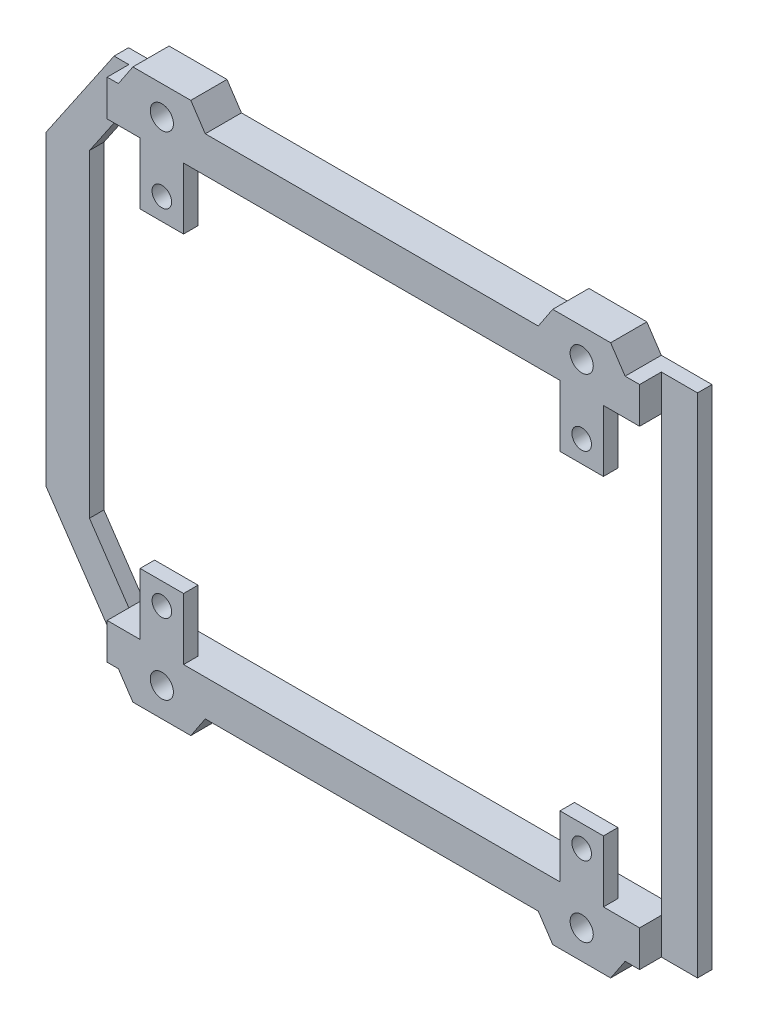
from build123d import *

# Parameters (mm, degrees)
BODY_DEPTH                       = 5
SIDE_EXTRUSION_DEPTH             = 5
MOUNTING_HOLE_D                  = 3.2
MOUNTING_CUTOUT_REACH            = 80.058
SKETCH7_W                        = 3
SKETCH7_H                        = 8.5
SKETCH8_R                        = 1.35
MOUNTING_HOLE_CUTOUT_DEPTH       = 62.424750712
MOUNTING_MIRROR2_COPY_1_DEPTH    = 5
MOUNTING_MIRROR2_COPY_2_D        = 3.2
MOUNTING_MIRROR2_COPY_3_REACH    = 80.058
MOUNTING_MIRROR2_COPY_3_SKETCH_W = 3
MOUNTING_MIRROR2_COPY_3_SKETCH_H = 8.5
MOUNTING_MIRROR2_COPY_4_SKETCH_R = 1.35
MOUNTING_MIRROR2_COPY_4_DEPTH    = 62.424750712
SKETCH9_W                        = 5
SKETCH9_H                        = 70
SKETCH9_W_2                      = 11.445654338
RPI_SPACING_CUTOUT_DEPTH         = 3


with BuildPart() as part:
    # Sketch3 → body (new body)
    with BuildSketch(Plane.XY):
        Polygon((-48, 21.182653996), (-48, -21.182653996), (-38.594438725, -35), (42, -35), (42, 35), (-38.594438725, 35), align=None)
        Polygon((-26, 21.5), (-26, 30), (26, 30), (26, 21.5), (32, 21.5), (32, 30), (37, 30), (37, -30), (32, -30), (32, -21.5), (26, -21.5), (26, -30), (-26, -30), (-26, -21.5), (-32, -21.5), (-32, -30), (-36.554345662, -30), (-42, -22), (-42, 22), (-36.554345662, 30), (-32, 30), (-32, 21.5), align=None, mode=Mode.SUBTRACT)
    extrude(amount=BODY_DEPTH)

    # Sketch4 → side_extrusion (add)
    with BuildSketch(Plane.XY):
        Polygon((-35, 35), (-33, 38), (-25, 38), (-23, 35), align=None)
    side_extrusion = extrude(amount=SIDE_EXTRUSION_DEPTH)

    # mounting_hole (through all)
    with Locations(Plane.XY.offset(5)):
        with Locations((-29, 34)):
            mounting_hole = Hole(MOUNTING_HOLE_D / 2)

    # Sketch7 → mounting_cutout (cut, up to next)
    with BuildSketch(Plane(origin=(-26, 0, 0), x_dir=(0, 0, -1), z_dir=(1, 0, 0)), mode=Mode.PRIVATE) as mounting_cutout_sk1:
        with Locations((-1.5, 25.75)):
            Rectangle(SKETCH7_W, SKETCH7_H)
    mounting_cutout_tool1 = extrude(mounting_cutout_sk1.sketch, amount=-MOUNTING_CUTOUT_REACH, mode=Mode.PRIVATE) & part.part
    mounting_cutout = mounting_cutout_tool1.solids().sort_by_distance((-26, 25.75, 1.5))[0]
    add(mounting_cutout, mode=Mode.SUBTRACT)

    # Sketch8 → mounting_hole_cutout (cut, through all)
    with BuildSketch(Plane.XY.offset(5)):
        with Locations((-29, 24.5)):
            Circle(SKETCH8_R)
    mounting_hole_cutout = extrude(amount=-MOUNTING_HOLE_CUTOUT_DEPTH, mode=Mode.SUBTRACT)

    # mounting_mirror1: side_extrusion, mounting_hole, mounting_cutout, mounting_hole_cutout across plane
    add(side_extrusion.mirror(Plane(origin=(0, 0, 0), x_dir=(0, 0, 1), z_dir=(1, 0, 0))))
    add(mounting_hole.mirror(Plane(origin=(0, 0, 0), x_dir=(0, 0, 1), z_dir=(1, 0, 0))), mode=Mode.SUBTRACT)
    add(mounting_cutout.mirror(Plane(origin=(0, 0, 0), x_dir=(0, 0, 1), z_dir=(1, 0, 0))), mode=Mode.SUBTRACT)
    add(mounting_hole_cutout.mirror(Plane(origin=(0, 0, 0), x_dir=(0, 0, 1), z_dir=(1, 0, 0))), mode=Mode.SUBTRACT)

    # mounting_mirror2: side_extrusion, mounting_hole, mounting_cutout, mounting_hole_cutout across plane
    add(side_extrusion.mirror(Plane.ZX))
    add(mounting_hole.mirror(Plane.ZX), mode=Mode.SUBTRACT)
    add(mounting_cutout.mirror(Plane.ZX), mode=Mode.SUBTRACT)
    add(mounting_hole_cutout.mirror(Plane.ZX), mode=Mode.SUBTRACT)

    # mounting_mirror2 copy 1 sketch → mounting_mirror2 copy 1 (add)
    with BuildSketch(Plane(origin=(0, 0, 0), x_dir=(-1, 0, 0), z_dir=(0, 0, 1))):
        Polygon((-35, 35), (-33, 38), (-25, 38), (-23, 35), align=None)
    extrude(amount=MOUNTING_MIRROR2_COPY_1_DEPTH)

    # mounting_mirror2 copy 2 (through all)
    with Locations(Plane(origin=(0, 0, 5), x_dir=(-1, 0, 0), z_dir=(0, 0, 1))):
        with Locations((-29, 34)):
            Hole(MOUNTING_MIRROR2_COPY_2_D / 2)

    # mounting_mirror2 copy 3 sketch → mounting_mirror2 copy 3 (cut, up to next)
    with BuildSketch(Plane(origin=(26, 0, 0), x_dir=(0, 0, -1), z_dir=(-1, 0, 0)), mode=Mode.PRIVATE) as mounting_mirror2_copy_3_sk1:
        with Locations((-1.5, 25.75)):
            Rectangle(MOUNTING_MIRROR2_COPY_3_SKETCH_W, MOUNTING_MIRROR2_COPY_3_SKETCH_H)
    mounting_mirror2_copy_3_tool1 = extrude(mounting_mirror2_copy_3_sk1.sketch, amount=-MOUNTING_MIRROR2_COPY_3_REACH, mode=Mode.PRIVATE) & part.part
    add(mounting_mirror2_copy_3_tool1.solids().sort_by_distance((26, -25.75, 1.5))[0], mode=Mode.SUBTRACT)

    # mounting_mirror2 copy 4 sketch → mounting_mirror2 copy 4 (cut, through all)
    with BuildSketch(Plane(origin=(0, 0, 5), x_dir=(-1, 0, 0), z_dir=(0, 0, 1))):
        with Locations((-29, 24.5)):
            Circle(MOUNTING_MIRROR2_COPY_4_SKETCH_R)
    extrude(amount=-MOUNTING_MIRROR2_COPY_4_DEPTH, mode=Mode.SUBTRACT)

    # Sketch9 → rpi_spacing_cutout (cut)
    with BuildSketch(Plane.XY.offset(5)):
        with Locations((39.5, 0)):
            Rectangle(SKETCH9_W, SKETCH9_H)
        with Locations((-42.277172831, 0)):
            Rectangle(SKETCH9_W_2, SKETCH9_H)
    extrude(amount=-RPI_SPACING_CUTOUT_DEPTH, mode=Mode.SUBTRACT)


solid = part.part
